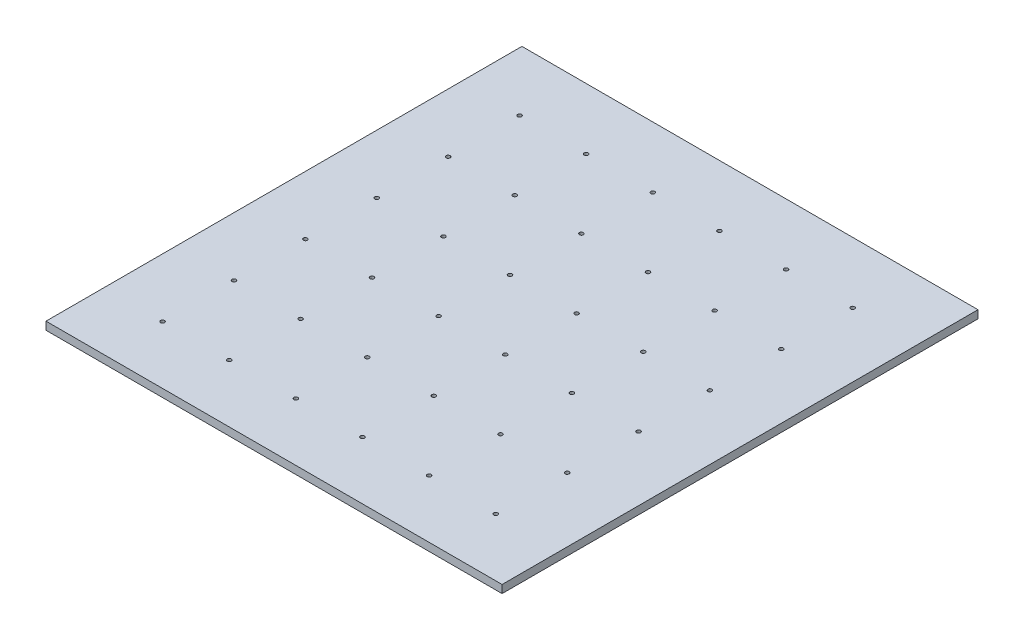
from build123d import *

# Parameters (mm, degrees)
SKETCH1_W           = 575
SKETCH1_H           = 600
BOSS_EXTRUDE1_DEPTH = 10
SKETCH2_R           = 2.5
CUT_EXTRUDE1_DEPTH  = 10


with BuildPart() as part:
    # Sketch1 → Boss-Extrude1 (new body)
    with BuildSketch(Plane(origin=(0, 0, 0), x_dir=(1, 0, 0), z_dir=(0, 1, 0))):
        with Locations((287.5, 300)):
            Rectangle(SKETCH1_W, SKETCH1_H)
    extrude(amount=BOSS_EXTRUDE1_DEPTH)

    # Sketch2 → Cut-Extrude1 (cut)
    with BuildSketch(Plane(origin=(0, 10, 0), x_dir=(1, 0, 0), z_dir=(0, 1, 0))):
        with Locations(Location((74, 73, 0), (0, 0, 270))):
            Circle(SKETCH2_R)
        with Locations(Location((158, 73, 0), (0, 0, 270))):
            Circle(SKETCH2_R)
        with Locations(Location((242, 73, 0), (0, 0, 270))):
            Circle(SKETCH2_R)
        with Locations(Location((326, 73, 0), (0, 0, 270))):
            Circle(SKETCH2_R)
        with Locations(Location((410, 73, 0), (0, 0, 270))):
            Circle(SKETCH2_R)
        with Locations(Location((494, 73, 0), (0, 0, 270))):
            Circle(SKETCH2_R)
        with Locations(Location((158, 163, 0), (0, 0, 270))):
            Circle(SKETCH2_R)
        with Locations(Location((242, 163, 0), (0, 0, 270))):
            Circle(SKETCH2_R)
        with Locations(Location((326, 163, 0), (0, 0, 270))):
            Circle(SKETCH2_R)
        with Locations(Location((410, 163, 0), (0, 0, 270))):
            Circle(SKETCH2_R)
        with Locations(Location((494, 163, 0), (0, 0, 270))):
            Circle(SKETCH2_R)
        with Locations(Location((158, 253, 0), (0, 0, 270))):
            Circle(SKETCH2_R)
        with Locations(Location((242, 253, 0), (0, 0, 270))):
            Circle(SKETCH2_R)
        with Locations(Location((326, 253, 0), (0, 0, 270))):
            Circle(SKETCH2_R)
        with Locations(Location((410, 253, 0), (0, 0, 270))):
            Circle(SKETCH2_R)
        with Locations(Location((494, 253, 0), (0, 0, 270))):
            Circle(SKETCH2_R)
        with Locations(Location((158, 343, 0), (0, 0, 270))):
            Circle(SKETCH2_R)
        with Locations(Location((242, 343, 0), (0, 0, 270))):
            Circle(SKETCH2_R)
        with Locations(Location((326, 343, 0), (0, 0, 270))):
            Circle(SKETCH2_R)
        with Locations(Location((410, 343, 0), (0, 0, 270))):
            Circle(SKETCH2_R)
        with Locations(Location((494, 343, 0), (0, 0, 270))):
            Circle(SKETCH2_R)
        with Locations(Location((158, 433, 0), (0, 0, 270))):
            Circle(SKETCH2_R)
        with Locations(Location((242, 433, 0), (0, 0, 270))):
            Circle(SKETCH2_R)
        with Locations(Location((326, 433, 0), (0, 0, 270))):
            Circle(SKETCH2_R)
        with Locations(Location((410, 433, 0), (0, 0, 270))):
            Circle(SKETCH2_R)
        with Locations(Location((494, 433, 0), (0, 0, 270))):
            Circle(SKETCH2_R)
        with Locations(Location((158, 523, 0), (0, 0, 270))):
            Circle(SKETCH2_R)
        with Locations(Location((242, 523, 0), (0, 0, 270))):
            Circle(SKETCH2_R)
        with Locations(Location((326, 523, 0), (0, 0, 270))):
            Circle(SKETCH2_R)
        with Locations(Location((410, 523, 0), (0, 0, 270))):
            Circle(SKETCH2_R)
        with Locations(Location((494, 523, 0), (0, 0, 270))):
            Circle(SKETCH2_R)
        with Locations(Location((74, 163, 0), (0, 0, 270))):
            Circle(SKETCH2_R)
        with Locations(Location((74, 253, 0), (0, 0, 270))):
            Circle(SKETCH2_R)
        with Locations(Location((74, 343, 0), (0, 0, 270))):
            Circle(SKETCH2_R)
        with Locations(Location((74, 433, 0), (0, 0, 270))):
            Circle(SKETCH2_R)
        with Locations(Location((74, 523, 0), (0, 0, 270))):
            Circle(SKETCH2_R)
    extrude(amount=-CUT_EXTRUDE1_DEPTH, mode=Mode.SUBTRACT)


solid = part.part
